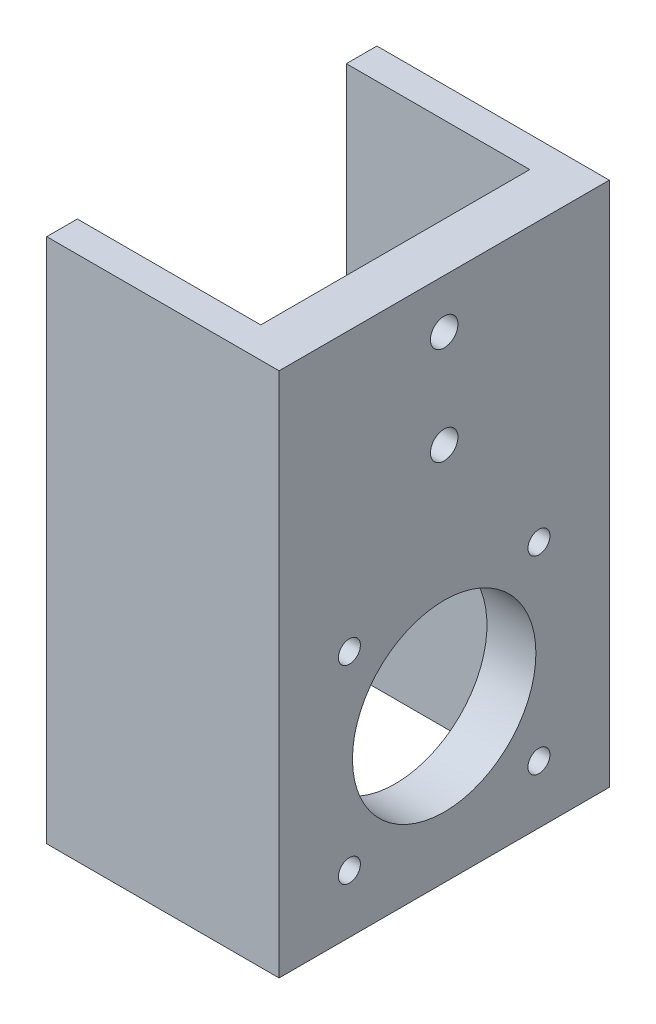
from build123d import *

# Parameters (mm, degrees)
SKETCH1_W           = 28
SKETCH1_H           = 28
SKETCH1_W_2         = 20
SKETCH1_H_2         = 20
BOSS_EXTRUDE1_DEPTH = 40
SKETCH2_R           = 2.25
CUT_EXTRUDE1_DEPTH  = 30
SKETCH5_W           = 50
SKETCH5_H           = 50
SKETCH5_R           = 1.8
SKETCH5_R_2         = 15
BOSS_EXTRUDE2_DEPTH = 4
SKETCH6_W           = 24
SKETCH6_H           = 28
CUT_EXTRUDE2_DEPTH  = 40
SKETCH7_W           = 4
SKETCH7_H           = 36
CUT_EXTRUDE3_DEPTH  = 4
SKETCH8_W           = 15
SKETCH8_H           = 36
BOSS_EXTRUDE3_DEPTH = 4
BOSS_EXTRUDE4_START = 4
SKETCH11_W          = 50
SKETCH11_H          = 86
SKETCH11_R          = 1.8
SKETCH11_R_2        = 15
SKETCH11_R_3        = 2.25
BOSS_EXTRUDE4_DEPTH = 4
SKETCH13_W          = 8
SKETCH13_H          = 86
BOSS_EXTRUDE5_DEPTH = 2
SKETCH14_W          = 8
SKETCH14_H          = 86
BOSS_EXTRUDE6_DEPTH = 2
SKETCH16_W          = 30
SKETCH16_H          = 86
BOSS_EXTRUDE7_DEPTH = 5


with BuildPart() as part:
    # Sketch1 → Boss-Extrude1 (new body)
    with BuildSketch(Plane(origin=(0, 0, 0), x_dir=(1, 0, 0), z_dir=(0, 1, 0))):
        Rectangle(SKETCH1_W, SKETCH1_H)
        Rectangle(SKETCH1_W_2, SKETCH1_H_2, mode=Mode.SUBTRACT)
    extrude(amount=BOSS_EXTRUDE1_DEPTH)

    # Sketch2 → Cut-Extrude1 (cut)
    with BuildSketch(Plane.ZY.offset(14)):
        with Locations((0, 32)):
            Circle(SKETCH2_R)
        with Locations((0, 16)):
            Circle(SKETCH2_R)
    extrude(amount=-CUT_EXTRUDE1_DEPTH, mode=Mode.SUBTRACT)

    # Sketch5 → Boss-Extrude2 (add)
    with BuildSketch(Plane.ZY.offset(14)):
        with Locations((0, -21)):
            Rectangle(SKETCH5_W, SKETCH5_H)
        with Locations((-15.499780644, -5.500219356)):
            Circle(SKETCH5_R, mode=Mode.SUBTRACT)
        with Locations((15.499780644, -5.500219356)):
            Circle(SKETCH5_R, mode=Mode.SUBTRACT)
        with Locations((15.499780644, -36.499780644)):
            Circle(SKETCH5_R, mode=Mode.SUBTRACT)
        with Locations((-15.499780644, -36.499780644)):
            Circle(SKETCH5_R, mode=Mode.SUBTRACT)
        with Locations((0, -21)):
            Circle(SKETCH5_R_2, mode=Mode.SUBTRACT)
    extrude(amount=-BOSS_EXTRUDE2_DEPTH)

    # Sketch6 → Cut-Extrude2 (cut)
    with BuildSketch(Plane.XZ):
        with Locations((2, 0)):
            Rectangle(SKETCH6_W, SKETCH6_H)
    extrude(amount=-CUT_EXTRUDE2_DEPTH, mode=Mode.SUBTRACT)

    # Sketch7 → Cut-Extrude3 (cut)
    with BuildSketch(Plane.ZY.offset(14)):
        with Locations((-12, 22)):
            Rectangle(SKETCH7_W, SKETCH7_H)
        with Locations((12, 22)):
            Rectangle(SKETCH7_W, SKETCH7_H)
    extrude(amount=-CUT_EXTRUDE3_DEPTH, mode=Mode.SUBTRACT)

    # Sketch8 → Boss-Extrude3 (add)
    with BuildSketch(Plane.ZY.offset(14)):
        with Locations((-17.5, 22)):
            Rectangle(SKETCH8_W, SKETCH8_H)
        with Locations((17.5, 22)):
            Rectangle(SKETCH8_W, SKETCH8_H)
    extrude(amount=-BOSS_EXTRUDE3_DEPTH)

    # Sketch11 → Boss-Extrude4 (add)
    with BuildSketch(Plane.ZY.offset(14).offset(BOSS_EXTRUDE4_START)):
        with Locations((0, -3)):
            Rectangle(SKETCH11_W, SKETCH11_H)
        with Locations((15.499780644, -5.500219356)):
            Circle(SKETCH11_R, mode=Mode.SUBTRACT)
        with Locations((15.499780644, -36.499780644)):
            Circle(SKETCH11_R, mode=Mode.SUBTRACT)
        with Locations((-15.499780644, -36.499780644)):
            Circle(SKETCH11_R, mode=Mode.SUBTRACT)
        with Locations((0, -21)):
            Circle(SKETCH11_R_2, mode=Mode.SUBTRACT)
        with Locations((0, 32)):
            Circle(SKETCH11_R_3, mode=Mode.SUBTRACT)
        with Locations((0, 16)):
            Circle(SKETCH11_R_3, mode=Mode.SUBTRACT)
        with Locations((-15.499780644, -5.500219356)):
            Circle(SKETCH11_R, mode=Mode.SUBTRACT)
    extrude(amount=-BOSS_EXTRUDE4_DEPTH)

    # Sketch13 → Boss-Extrude5 (add)
    with BuildSketch(Plane.XY.offset(25)):
        with Locations((-14, -3)):
            Rectangle(SKETCH13_W, SKETCH13_H)
    extrude(amount=BOSS_EXTRUDE5_DEPTH)

    # Sketch14 → Boss-Extrude6 (add)
    with BuildSketch(Plane(origin=(0, 0, -25), x_dir=(-1, 0, 0), z_dir=(0, 0, -1))):
        with Locations((14, -3)):
            Rectangle(SKETCH14_W, SKETCH14_H)
    extrude(amount=BOSS_EXTRUDE6_DEPTH)

    # Sketch16 → Boss-Extrude7 (add)
    with BuildSketch(Plane(origin=(0, 0, -27), x_dir=(-1, 0, 0), z_dir=(0, 0, -1))):
        with Locations((33, -3)):
            Rectangle(SKETCH16_W, SKETCH16_H)
    boss_extrude7 = extrude(amount=-BOSS_EXTRUDE7_DEPTH)

    # Mirror1: Boss-Extrude7 across plane
    add(boss_extrude7.mirror(Plane.XY))


solid = part.part
